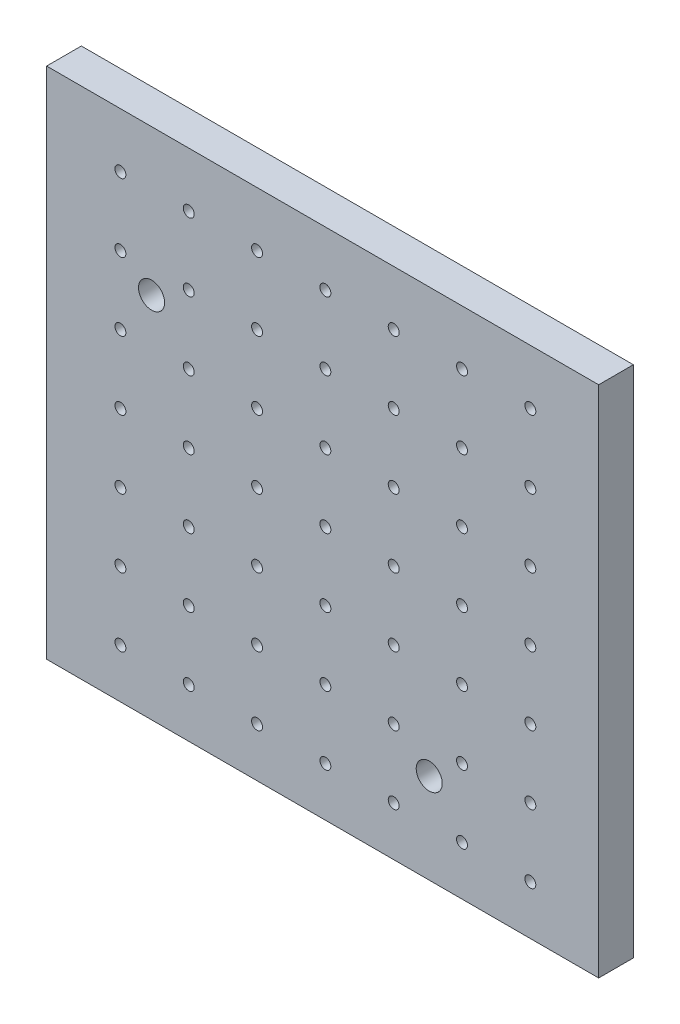
from build123d import *

# Parameters (mm, degrees)
CROQUIS1_W              = 202
CROQUIS1_H              = 188
SALIENTE_EXTRUIR1_DEPTH = 12.7
CROQUIS2_R              = 2
CROQUIS2_R_2            = 4.765
CORTAR_EXTRUIR1_DEPTH   = 12.7


with BuildPart() as part:
    # Croquis1 → Saliente-Extruir1 (new body)
    with BuildSketch(Plane.XY):
        Rectangle(CROQUIS1_W, CROQUIS1_H)
    extrude(amount=SALIENTE_EXTRUIR1_DEPTH)

    # Croquis2 → Cortar-Extruir1 (cut)
    with BuildSketch(Plane.XY.offset(12.7)):
        with Locations((-74, -76)):
            Circle(CROQUIS2_R)
        with Locations((-49, -76)):
            Circle(CROQUIS2_R)
        with Locations((-24, -76)):
            Circle(CROQUIS2_R)
        with Locations((1, -76)):
            Circle(CROQUIS2_R)
        with Locations((26, -76)):
            Circle(CROQUIS2_R)
        with Locations((51, -76)):
            Circle(CROQUIS2_R)
        with Locations((76, -76)):
            Circle(CROQUIS2_R)
        with Locations((-49, -51)):
            Circle(CROQUIS2_R)
        with Locations((-24, -51)):
            Circle(CROQUIS2_R)
        with Locations((1, -51)):
            Circle(CROQUIS2_R)
        with Locations((26, -51)):
            Circle(CROQUIS2_R)
        with Locations((51, -51)):
            Circle(CROQUIS2_R)
        with Locations((76, -51)):
            Circle(CROQUIS2_R)
        with Locations((-49, -26)):
            Circle(CROQUIS2_R)
        with Locations((-24, -26)):
            Circle(CROQUIS2_R)
        with Locations((1, -26)):
            Circle(CROQUIS2_R)
        with Locations((26, -26)):
            Circle(CROQUIS2_R)
        with Locations((51, -26)):
            Circle(CROQUIS2_R)
        with Locations((76, -26)):
            Circle(CROQUIS2_R)
        with Locations((-49, -1)):
            Circle(CROQUIS2_R)
        with Locations((-24, -1)):
            Circle(CROQUIS2_R)
        with Locations((1, -1)):
            Circle(CROQUIS2_R)
        with Locations((26, -1)):
            Circle(CROQUIS2_R)
        with Locations((51, -1)):
            Circle(CROQUIS2_R)
        with Locations((76, -1)):
            Circle(CROQUIS2_R)
        with Locations((-49, 24)):
            Circle(CROQUIS2_R)
        with Locations((-24, 24)):
            Circle(CROQUIS2_R)
        with Locations((1, 24)):
            Circle(CROQUIS2_R)
        with Locations((26, 24)):
            Circle(CROQUIS2_R)
        with Locations((51, 24)):
            Circle(CROQUIS2_R)
        with Locations((76, 24)):
            Circle(CROQUIS2_R)
        with Locations((-49, 49)):
            Circle(CROQUIS2_R)
        with Locations((-24, 49)):
            Circle(CROQUIS2_R)
        with Locations((1, 49)):
            Circle(CROQUIS2_R)
        with Locations((26, 49)):
            Circle(CROQUIS2_R)
        with Locations((51, 49)):
            Circle(CROQUIS2_R)
        with Locations((76, 49)):
            Circle(CROQUIS2_R)
        with Locations((-49, 74)):
            Circle(CROQUIS2_R)
        with Locations((-24, 74)):
            Circle(CROQUIS2_R)
        with Locations((1, 74)):
            Circle(CROQUIS2_R)
        with Locations((26, 74)):
            Circle(CROQUIS2_R)
        with Locations((51, 74)):
            Circle(CROQUIS2_R)
        with Locations((76, 74)):
            Circle(CROQUIS2_R)
        with Locations((-74, -51)):
            Circle(CROQUIS2_R)
        with Locations((-74, -26)):
            Circle(CROQUIS2_R)
        with Locations((-74, -1)):
            Circle(CROQUIS2_R)
        with Locations((-74, 24)):
            Circle(CROQUIS2_R)
        with Locations((-74, 49)):
            Circle(CROQUIS2_R)
        with Locations((-74, 74)):
            Circle(CROQUIS2_R)
        with Locations((39, -61)):
            Circle(CROQUIS2_R_2)
        with Locations((-62.6, 40.6)):
            Circle(CROQUIS2_R_2)
    extrude(amount=-CORTAR_EXTRUIR1_DEPTH, mode=Mode.SUBTRACT)


solid = part.part
